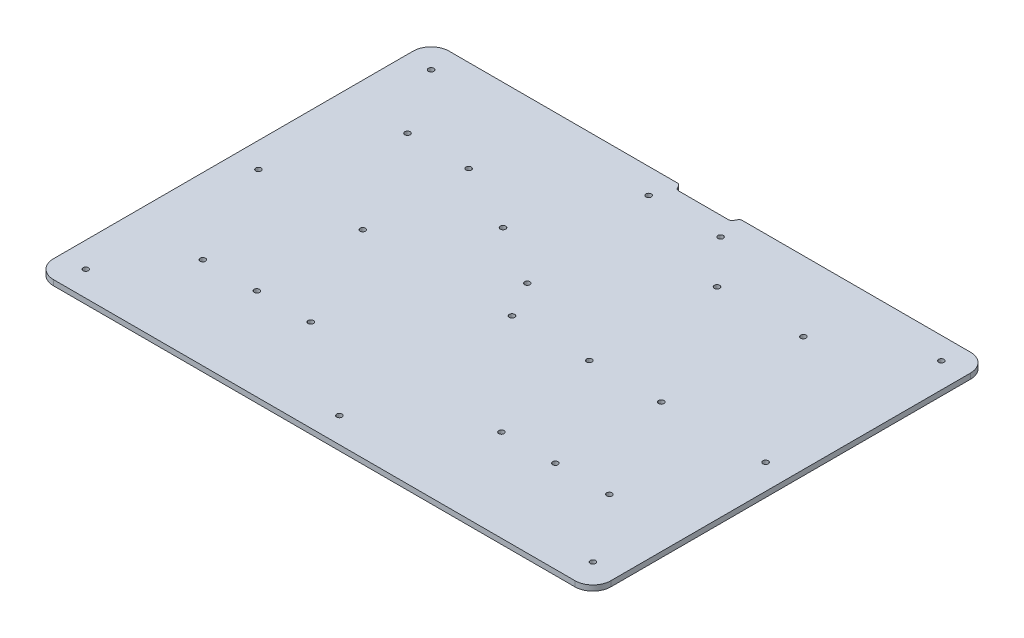
from build123d import *

# Parameters (mm, degrees)
SKETCH_1_R      = 1.5
EXTRUDE_1_DEPTH = 3


with BuildPart() as part:
    # 草图1 → 凸台-拉伸1 (new body)
    with BuildSketch(Plane(origin=(0, 0, 0), x_dir=(1, 0, 0), z_dir=(0, 1, 0))):
        with BuildLine():
            Line((10, 0), (136.884360712, 0))
            ThreePointArc((136.884360712, 0), (137.900113715, -0.277140216), (138.634360712, -1.031754163))
            Line((138.634360712, -1.031754163), (139.429147615, -2.468245837))
            ThreePointArc((139.429147615, -2.468245837), (140.163394612, -3.222859784), (141.179147615, -3.5))
            Line((141.179147615, -3.5), (143.5, -3.5))
            Line((143.5, -3.5), (166.5, -3.5))
            Line((166.5, -3.5), (168.820852385, -3.5))
            ThreePointArc((168.820852385, -3.5), (169.836605388, -3.222859784), (170.570852385, -2.468245837))
            Line((170.570852385, -2.468245837), (171.365639288, -1.031754163))
            ThreePointArc((171.365639288, -1.031754163), (172.099886285, -0.277140216), (173.115639288, 0))
            Line((173.115639288, 0), (300, 0))
            ThreePointArc((300, 0), (307.071067812, -2.928932188), (310, -10))
            Line((310, -10), (310, -210))
            ThreePointArc((310, -210), (307.071067812, -217.071067812), (300, -220))
            Line((300, -220), (10, -220))
            ThreePointArc((10, -220), (2.928932188, -217.071067812), (0, -210))
            Line((0, -210), (0, -10))
            ThreePointArc((0, -10), (2.928932188, -2.928932188), (10, 0))
        make_face()
        with Locations(Location((14, -14, 0), (0, 0, 270))):
            Circle(SKETCH_1_R, mode=Mode.SUBTRACT)
        with Locations(Location((14, -206, 0), (0, 0, 270))):
            Circle(SKETCH_1_R, mode=Mode.SUBTRACT)
        with Locations(Location((296, -206, 0), (0, 0, 270))):
            Circle(SKETCH_1_R, mode=Mode.SUBTRACT)
        with Locations(Location((296, -12.28568254, 0), (0, 0, 270))):
            Circle(SKETCH_1_R, mode=Mode.SUBTRACT)
        with Locations(Location((155, -206, 0), (0, 0, 270))):
            Circle(SKETCH_1_R, mode=Mode.SUBTRACT)
        with Locations(Location((175, -14, 0), (0, 0, 270))):
            Circle(SKETCH_1_R, mode=Mode.SUBTRACT)
        with Locations(Location((135, -14, 0), (0, 0, 270))):
            Circle(SKETCH_1_R, mode=Mode.SUBTRACT)
        with Locations(Location((296, -110, 0), (0, 0, 270))):
            Circle(SKETCH_1_R, mode=Mode.SUBTRACT)
        with Locations(Location((14, -110, 0), (0, 0, 270))):
            Circle(SKETCH_1_R, mode=Mode.SUBTRACT)
        with Locations(Location((155, -110, 0), (0, 0, 270))):
            Circle(SKETCH_1_R, mode=Mode.SUBTRACT)
        with Locations(Location((72, -110, 0), (0, 0, 270))):
            Circle(SKETCH_1_R, mode=Mode.SUBTRACT)
        with Locations(Location((72, -168.903225806, 0), (0, 0, 270))):
            Circle(SKETCH_1_R, mode=Mode.SUBTRACT)
        with Locations(Location((72, -51.096774194, 0), (0, 0, 270))):
            Circle(SKETCH_1_R, mode=Mode.SUBTRACT)
        with Locations(Location((42, -168.903225806, 0), (0, 0, 270))):
            Circle(SKETCH_1_R, mode=Mode.SUBTRACT)
        with Locations(Location((102, -168.903225806, 0), (0, 0, 270))):
            Circle(SKETCH_1_R, mode=Mode.SUBTRACT)
        with Locations(Location((238, -110, 0), (0, 0, 270))):
            Circle(SKETCH_1_R, mode=Mode.SUBTRACT)
        with Locations(Location((238, -168.903225806, 0), (0, 0, 270))):
            Circle(SKETCH_1_R, mode=Mode.SUBTRACT)
        with Locations(Location((268, -168.903225806, 0), (0, 0, 270))):
            Circle(SKETCH_1_R, mode=Mode.SUBTRACT)
        with Locations(Location((208, -168.903225806, 0), (0, 0, 270))):
            Circle(SKETCH_1_R, mode=Mode.SUBTRACT)
        with Locations(Location((246, -39, 0), (0, 0, 270))):
            Circle(SKETCH_1_R, mode=Mode.SUBTRACT)
        with Locations(Location((198, -39, 0), (0, 0, 270))):
            Circle(SKETCH_1_R, mode=Mode.SUBTRACT)
        with Locations(Location((110, -70, 0), (0, 0, 270))):
            Circle(SKETCH_1_R, mode=Mode.SUBTRACT)
        with Locations(Location((38, -51.096774194, 0), (0, 0, 270))):
            Circle(SKETCH_1_R, mode=Mode.SUBTRACT)
        with Locations(Location((198, -110, 0), (0, 0, 270))):
            Circle(SKETCH_1_R, mode=Mode.SUBTRACT)
        with Locations(Location((143.5, -90, 0), (0, 0, 270))):
            Circle(SKETCH_1_R, mode=Mode.SUBTRACT)
    extrude(amount=EXTRUDE_1_DEPTH)


solid = part.part
